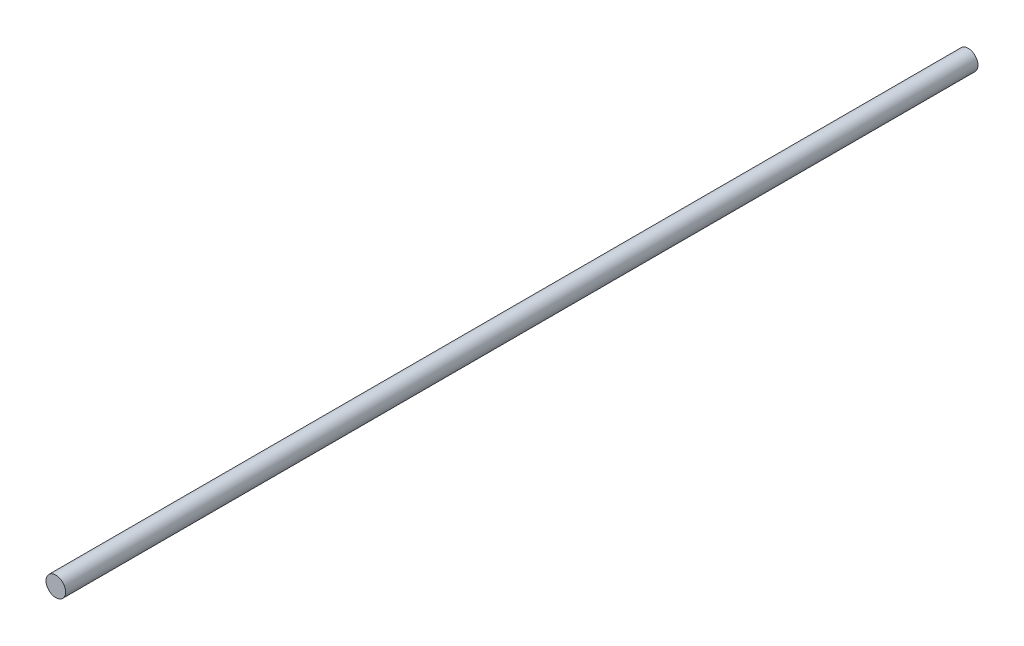
from build123d import *

# Parameters (mm, degrees)
SKETCH1_R           = 6.35
BOSS_EXTRUDE1_DEPTH = 590.3


with BuildPart() as part:
    # Sketch1 → Boss-Extrude1 (new body)
    with BuildSketch(Plane.XY):
        Circle(SKETCH1_R)
    extrude(amount=BOSS_EXTRUDE1_DEPTH)


solid = part.part
